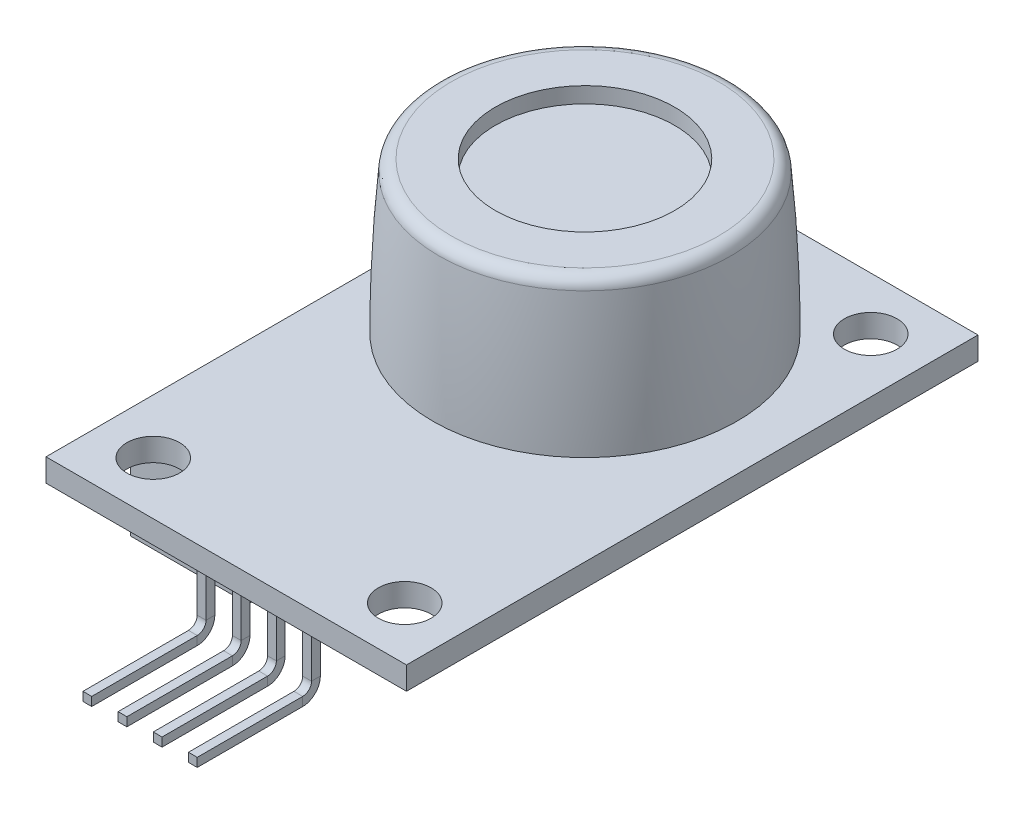
from build123d import *

# Parameters (mm, degrees)
EXTRUDE_1_DEPTH     = 1.2
SKETCH_3_R          = 0.5
EXTRUDE_2_DEPTH     = 5.8
CHAMFER_1_SIZE      = 0.2
SKETCH1_W           = 20.5
SKETCH1_H           = 32.5
SKETCH1_R           = 1.5
BOSS_EXTRUDE1_DEPTH = 1.3
SKETCH2_W           = 6.7
SKETCH2_H           = 6.7
BOSS_EXTRUDE2_DEPTH = 5
SKETCH3_W           = 0.5
SKETCH3_H           = 0.5
SKETCH5_R           = 1.5
CUT_EXTRUDE1_DEPTH  = 0.2
CUT_EXTRUDE2_DEPTH  = 0.2


with BuildPart() as part:
    # Эскиз1 → Повернуть1 (revolve)
    with BuildSketch(Plane(origin=(0, 0, 0), x_dir=(0, 0, -1), z_dir=(1, 0, 0))):
        with BuildLine():
            Line((0, 1.2), (-7.05, 1.2))
            Line((-7.05, 1.2), (-7.25, 1.4))
            Line((-7.25, 1.4), (-7.65, 1))
            Line((-7.65, 1), (-8.65, 1))
            ThreePointArc((-8.65, 1), (-8.561771126, 4.984856949), (-8.297257426, 8.96190381))
            ThreePointArc((-8.297257426, 8.96190381), (-8.072581915, 9.416397457), (-7.6, 9.6))
            Line((-7.6, 9.6), (-5.1, 9.6))
            Line((-5.1, 9.6), (-5.1, 8.7))
            Line((-5.1, 8.7), (0, 8.7))
            Line((0, 8.7), (0, 1.2))
        make_face()
    revolve(axis=Axis((0, 8.7, 0), (0, -1, 0)))

    # Эскиз2 → Бобышка-Вытянуть1 (add)
    with BuildSketch(Plane.XZ.offset(-1.2)):
        with BuildLine():
            ThreePointArc((-2.368807717, 2.368807717), (-2.368807717, 4.384062043), (-4.384062043, 4.384062043))
            ThreePointArc((-4.384062043, 4.384062043), (-6.2, 0), (-4.384062043, -4.384062043))
            ThreePointArc((-4.384062043, -4.384062043), (-2.368807717, -4.384062043), (-2.368807717, -2.368807717))
            ThreePointArc((-2.368807717, -2.368807717), (-3.35, 0), (-2.368807717, 2.368807717))
        make_face()
        with BuildLine():
            ThreePointArc((4.384062043, -4.384062043), (5.728053102, -2.372637281), (6.2, 0))
            ThreePointArc((6.2, 0), (5.728053102, 2.372637281), (4.384062043, 4.384062043))
            ThreePointArc((4.384062043, 4.384062043), (2.368807717, 4.384062043), (2.368807717, 2.368807717))
            ThreePointArc((2.368807717, 2.368807717), (3.094996434, 1.281989498), (3.35, 0))
            ThreePointArc((3.35, 0), (3.094996434, -1.281989498), (2.368807717, -2.368807717))
            ThreePointArc((2.368807717, -2.368807717), (2.368807717, -4.384062043), (4.384062043, -4.384062043))
        make_face()
    extrude(amount=EXTRUDE_1_DEPTH)

    # Эскиз3 → Бобышка-Вытянуть2 (add)
    with BuildSketch(Plane.XZ):
        with Locations(Location((-4.75, 0, 0), (0, 0, 270))):
            Circle(SKETCH_3_R)
        with Locations(Location((-3.358757211, 3.358757211, 0), (0, 0, 270))):
            Circle(SKETCH_3_R)
        with Locations(Location((-3.358757211, -3.358757211, 0), (0, 0, 270))):
            Circle(SKETCH_3_R)
        with Locations(Location((3.358757211, 3.358757211, 0), (0, 0, 90))):
            Circle(SKETCH_3_R)
        with Locations(Location((4.75, 0, 0), (0, 0, 90))):
            Circle(SKETCH_3_R)
        with Locations(Location((3.358757211, -3.358757211, 0), (0, 0, 90))):
            Circle(SKETCH_3_R)
    extrude(amount=EXTRUDE_2_DEPTH)

    # Фаска1
    chamfer_1_edges = [part.edges().sort_by_distance(p)[0] for p in [
        (-4.75, -5.8, 0.5),
        (-3.358757211, -5.8, 3.858757211),
        (-3.358757211, -5.8, -2.858757211),
        (3.358757211, -5.8, 2.858757211),
        (4.75, -5.8, -0.5),
        (3.358757211, -5.8, -3.858757211),
    ]]
    chamfer(chamfer_1_edges, length=CHAMFER_1_SIZE)


with BuildPart() as body_2:
    # Sketch1 → Boss-Extrude1 (new body)
    with BuildSketch(Plane.XZ):
        with Locations((0, 4.15)):
            Rectangle(SKETCH1_W, SKETCH1_H)
        with Locations(Location((-7.15, 17.4, 0), (0, 0, 270))):
            Circle(SKETCH1_R, mode=Mode.SUBTRACT)
        with Locations(Location((7.15, 17.4, 0), (0, 0, 270))):
            Circle(SKETCH1_R, mode=Mode.SUBTRACT)
        with Locations(Location((7.15, -9.1, 0), (0, 0, 270))):
            Circle(SKETCH1_R, mode=Mode.SUBTRACT)
        with Locations(Location((-7.15, -9.1, 0), (0, 0, 270))):
            Circle(SKETCH1_R, mode=Mode.SUBTRACT)
    extrude(amount=BOSS_EXTRUDE1_DEPTH)

    # Sweep1: sweep along a path in Sketch4
    with BuildLine(Plane.ZY.offset(10.25)) as sweep1_path:
        Line((18.4, 0), (18.4, -5))
        ThreePointArc((18.4, -5), (18.692893219, -5.707106781), (19.4, -6))
        Line((19.4, -6), (25.4, -6))
    # Sketch3 → Sweep1 (sweep)
    with BuildSketch(Plane(origin=(0, 0, 0), x_dir=(1, 0, 0), z_dir=(0, 1, 0))):
        with Locations((-0.9, -18.65)):
            Rectangle(SKETCH3_W, SKETCH3_H)
        with Locations((-2.9, -18.65)):
            Rectangle(SKETCH3_W, SKETCH3_H)
        with Locations((1.1, -18.65)):
            Rectangle(SKETCH3_W, SKETCH3_H)
        with Locations((3.1, -18.65)):
            Rectangle(SKETCH3_W, SKETCH3_H)
    sweep(path=sweep1_path.line)


with BuildPart() as body_3:
    # Sketch2 → Boss-Extrude2 (new body)
    with BuildSketch(Plane.XZ.offset(1.3)):
        with Locations((-6.9, 12.25)):
            Rectangle(SKETCH2_W, SKETCH2_H)
    extrude(amount=BOSS_EXTRUDE2_DEPTH)

    # Sketch5 → Cut-Extrude1 (cut)
    with BuildSketch(Plane.XZ.offset(6.3)):
        with Locations(Location((-6.9, 12.25, 0), (0, 0, 270))):
            Circle(SKETCH5_R)
    extrude(amount=-CUT_EXTRUDE1_DEPTH, mode=Mode.SUBTRACT)

    # Sketch6 → Cut-Extrude2 (cut)
    with BuildSketch(Plane.XZ.offset(6.1)):
        Polygon((-6.86, 12.21), (-6.86, 10.750533428), (-6.937413609, 10.750533428), (-6.937413609, 12.21), (-8.399466572, 12.21), (-8.399466572, 12.29), (-6.937413609, 12.29), (-6.937413609, 13.749533335), (-6.86, 13.749533335), (-6.86, 12.29), (-5.400533428, 12.29), (-5.400533428, 12.21), align=None)
    extrude(amount=-CUT_EXTRUDE2_DEPTH, mode=Mode.SUBTRACT)


solid = Compound([part.part, body_2.part, body_3.part])
